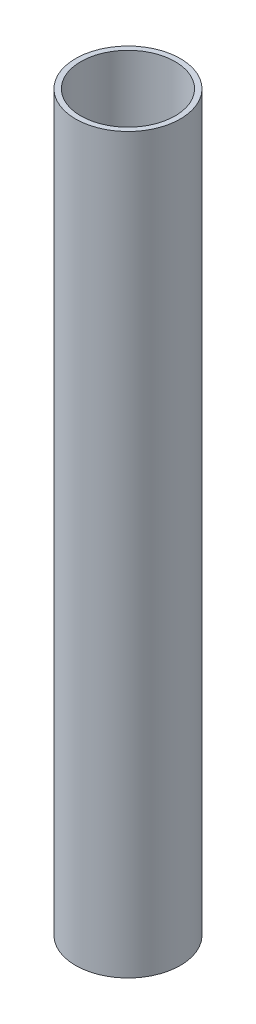
from build123d import *

# Parameters (mm, degrees)
SKETCH1_R           = 1.27
SKETCH1_R_2         = 1.143
BOSS_EXTRUDE1_DEPTH = 17.78


with BuildPart() as part:
    # Sketch1 → Boss-Extrude1 (new body)
    with BuildSketch(Plane(origin=(0, 0, 0), x_dir=(1, 0, 0), z_dir=(0, 1, 0))):
        with Locations(Location((0, 0, 0), (0, 0, 270))):
            Circle(SKETCH1_R)
        with Locations(Location((0, 0, 0), (0, 0, 270))):
            Circle(SKETCH1_R_2, mode=Mode.SUBTRACT)
    extrude(amount=BOSS_EXTRUDE1_DEPTH)


solid = part.part
